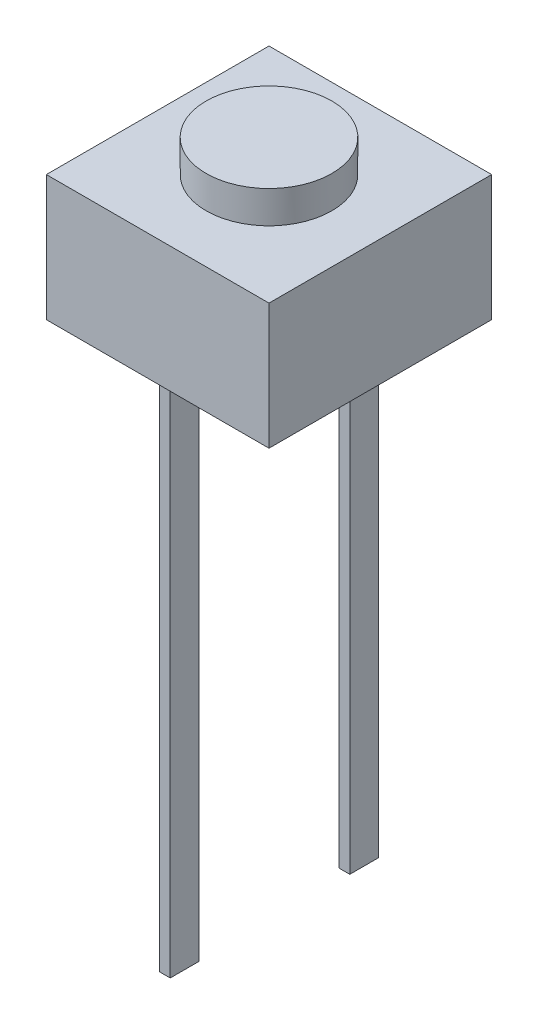
from build123d import *

# Parameters (mm, degrees)
SKETCH_1_W      = 6.2
SKETCH_1_H      = 6.2
EXTRUDE_1_DEPTH = 3.5
SKETCH_2_R      = 1.75
EXTRUDE_2_DEPTH = 0.9
SKETCH_3_W      = 0.3
SKETCH_3_H      = 0.8
EXTRUDE_3_DEPTH = 14.35


with BuildPart() as part:
    # Эскиз1 → Бобышка-Вытянуть1 (new body)
    with BuildSketch(Plane(origin=(0, 0, 0), x_dir=(1, 0, 0), z_dir=(0, 1, 0))):
        Rectangle(SKETCH_1_W, SKETCH_1_H)
    extrude(amount=EXTRUDE_1_DEPTH)

    # Эскиз2 → Бобышка-Вытянуть2 (add)
    with BuildSketch(Plane(origin=(0, 3.5, 0), x_dir=(1, 0, 0), z_dir=(0, 1, 0))):
        with Locations(Location((0, 0, 0), (0, 0, 90))):
            Circle(SKETCH_2_R)
    extrude(amount=EXTRUDE_2_DEPTH)

    # Эскиз3 → Бобышка-Вытянуть3 (add)
    with BuildSketch(Plane.XZ):
        with Locations((0, 2.5)):
            Rectangle(SKETCH_3_W, SKETCH_3_H)
        with Locations((0, -2.5)):
            Rectangle(SKETCH_3_W, SKETCH_3_H)
    extrude(amount=EXTRUDE_3_DEPTH)


solid = part.part
